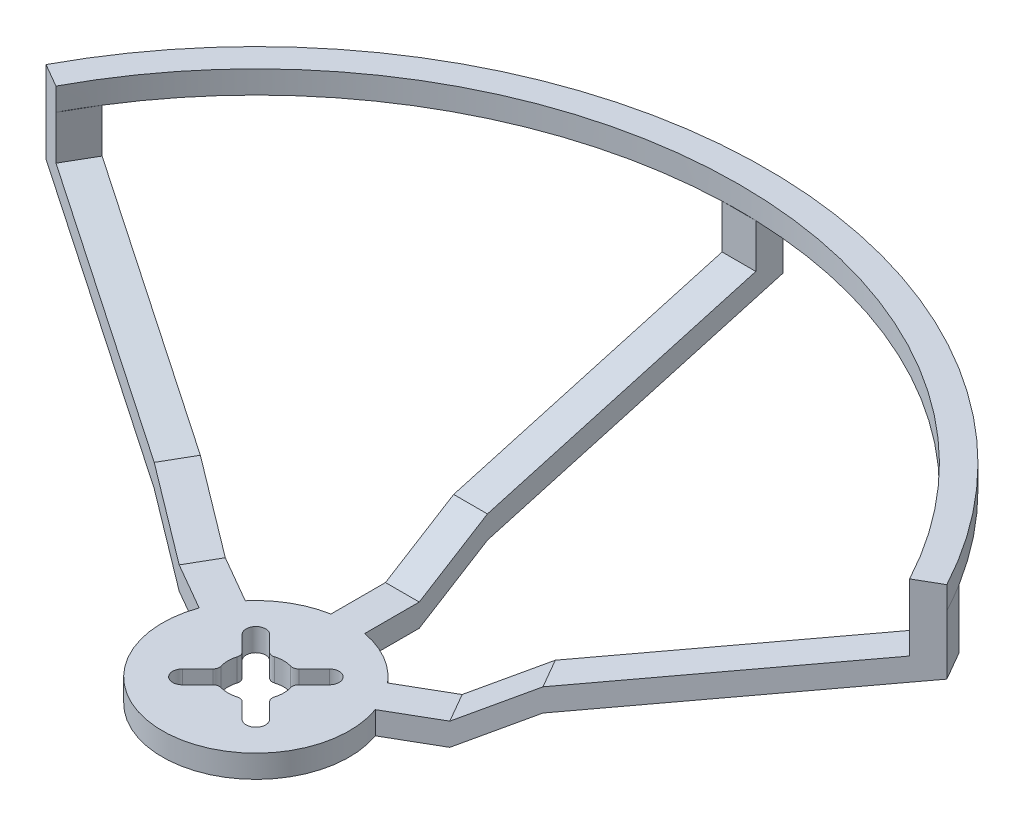
from build123d import *

# Parameters (mm, degrees)
EXTRUDE_1_DEPTH          = 3.5
EXTRUDE_2_DEPTH          = 2.6
PATTERN_CIRCULAR_1_COUNT = 2
PATTERN_CIRCULAR_1_ANGLE = 60
PATTERN_CIRCULAR_2_COUNT = 2
PATTERN_CIRCULAR_2_ANGLE = 60
EXTRUDE_3_DEPTH          = 3.5


with BuildPart() as part:
    # 草图1 → 凸台-拉伸1 (new body)
    with BuildSketch(Plane(origin=(0, 0, 0), x_dir=(1, 0, 0), z_dir=(0, 1, 0))):
        with BuildLine():
            Line((-2.6, 22.563332941), (2.6, 22.563332941))
            Line((2.6, 22.563332941), (2.6, 14.163332941))
            ThreePointArc((2.6, 14.163332941), (7.2, 12.470765814), (10.965806129, 9.33333252))
            Line((10.965806129, 9.33333252), (18.240419521, 13.53333252))
            Line((18.240419521, 13.53333252), (20.840419521, 9.030000421))
            Line((20.840419521, 9.030000421), (13.565806129, 4.830000421))
            ThreePointArc((13.565806129, 4.830000421), (0, -14.4), (-13.565806129, 4.830000421))
            Line((-13.565806129, 4.830000421), (-20.840419521, 9.030000421))
            Line((-20.840419521, 9.030000421), (-18.240419521, 13.53333252))
            Line((-18.240419521, 13.53333252), (-10.965806129, 9.33333252))
            ThreePointArc((-10.965806129, 9.33333252), (-7.2, 12.470765814), (-2.6, 14.163332941))
            Line((-2.6, 14.163332941), (-2.6, 22.563332941))
        make_face()
        with BuildLine():
            Line((4.596194078, 6.717514421), (2.243882157, 4.3652025))
            ThreePointArc((2.243882157, 4.3652025), (1.77992131, 4.102319563), (1.246817757, 4.115269794))
            ThreePointArc((1.246817757, 4.115269794), (0, 4.3), (-1.246817757, 4.115269794))
            ThreePointArc((-1.246817757, 4.115269794), (-1.77992131, 4.102319563), (-2.243882157, 4.3652025))
            Line((-2.243882157, 4.3652025), (-4.596194078, 6.717514421))
            ThreePointArc((-4.596194078, 6.717514421), (-6.717514421, 6.717514421), (-6.717514421, 4.596194078))
            Line((-6.717514421, 4.596194078), (-4.3652025, 2.243882157))
            ThreePointArc((-4.3652025, 2.243882157), (-4.102319563, 1.77992131), (-4.115269794, 1.246817757))
            ThreePointArc((-4.115269794, 1.246817757), (-4.3, 0), (-4.115269794, -1.246817757))
            ThreePointArc((-4.115269794, -1.246817757), (-4.102319563, -1.77992131), (-4.3652025, -2.243882157))
            Line((-4.3652025, -2.243882157), (-6.717514421, -4.596194078))
            ThreePointArc((-6.717514421, -4.596194078), (-6.717514421, -6.717514421), (-4.596194078, -6.717514421))
            Line((-4.596194078, -6.717514421), (-2.243882157, -4.3652025))
            ThreePointArc((-2.243882157, -4.3652025), (-1.77992131, -4.102319563), (-1.246817757, -4.115269794))
            ThreePointArc((-1.246817757, -4.115269794), (0, -4.3), (1.246817757, -4.115269794))
            ThreePointArc((1.246817757, -4.115269794), (1.77992131, -4.102319563), (2.243882157, -4.3652025))
            Line((2.243882157, -4.3652025), (4.596194078, -6.717514421))
            ThreePointArc((4.596194078, -6.717514421), (6.717514421, -6.717514421), (6.717514421, -4.596194078))
            Line((6.717514421, -4.596194078), (4.3652025, -2.243882157))
            ThreePointArc((4.3652025, -2.243882157), (4.102319563, -1.77992131), (4.115269794, -1.246817757))
            ThreePointArc((4.115269794, -1.246817757), (4.3, 0), (4.115269794, 1.246817757))
            ThreePointArc((4.115269794, 1.246817757), (4.102319563, 1.77992131), (4.3652025, 2.243882157))
            Line((4.3652025, 2.243882157), (6.717514421, 4.596194078))
            ThreePointArc((6.717514421, 4.596194078), (6.717514421, 6.717514421), (4.596194078, 6.717514421))
        make_face(mode=Mode.SUBTRACT)
    extrude(amount=EXTRUDE_1_DEPTH)

    # 草图2 → 凸台-拉伸2 (add, symmetric)
    with BuildSketch(Plane(origin=(0, 0, 0), x_dir=(0, 0, -1), z_dir=(1, 0, 0))):
        Polygon((22.563332941, 3.5), (33.063332941, 10), (74.4, 21.673878936), (74.4, 28.46), (78.6, 28.46), (78.6, 19.36), (33.063332941, 6.5), (22.563332941, 0), align=None)
    extrude_2 = extrude(amount=EXTRUDE_2_DEPTH, both=True)

    # 阵列(圆周)1: 凸台-拉伸2 ×2 about axis
    pattern_circular_1_axis = Axis((0, 3.5, 0), (0, 1, 0))
    for i in range(1, PATTERN_CIRCULAR_1_COUNT):
        add(extrude_2.rotate(pattern_circular_1_axis, i * PATTERN_CIRCULAR_1_ANGLE / (PATTERN_CIRCULAR_1_COUNT - 1)))

    # 阵列(圆周)2: 凸台-拉伸2 ×2 about axis
    pattern_circular_2_axis = Axis((0, 3.5, 0), (0, -1, 0))
    for i in range(1, PATTERN_CIRCULAR_2_COUNT):
        add(extrude_2.rotate(pattern_circular_2_axis, i * PATTERN_CIRCULAR_2_ANGLE / (PATTERN_CIRCULAR_2_COUNT - 1)))

    # 草图3 → 凸台-拉伸3 (add)
    with BuildSketch(Plane(origin=(0, 28.46, 0), x_dir=(1, 0, 0), z_dir=(0, 1, 0))):
        with BuildLine():
            Line((-69.369596737, 37.04833395), (-65.732290042, 34.94833395))
            ThreePointArc((-65.732290042, 34.94833395), (0, 74.445416246), (65.732290042, 34.94833395))
            Line((65.732290042, 34.94833395), (69.369596737, 37.04833395))
            ThreePointArc((69.369596737, 37.04833395), (0, 78.642990787), (-69.369596737, 37.04833395))
        make_face()
    extrude(amount=EXTRUDE_3_DEPTH)


solid = part.part
